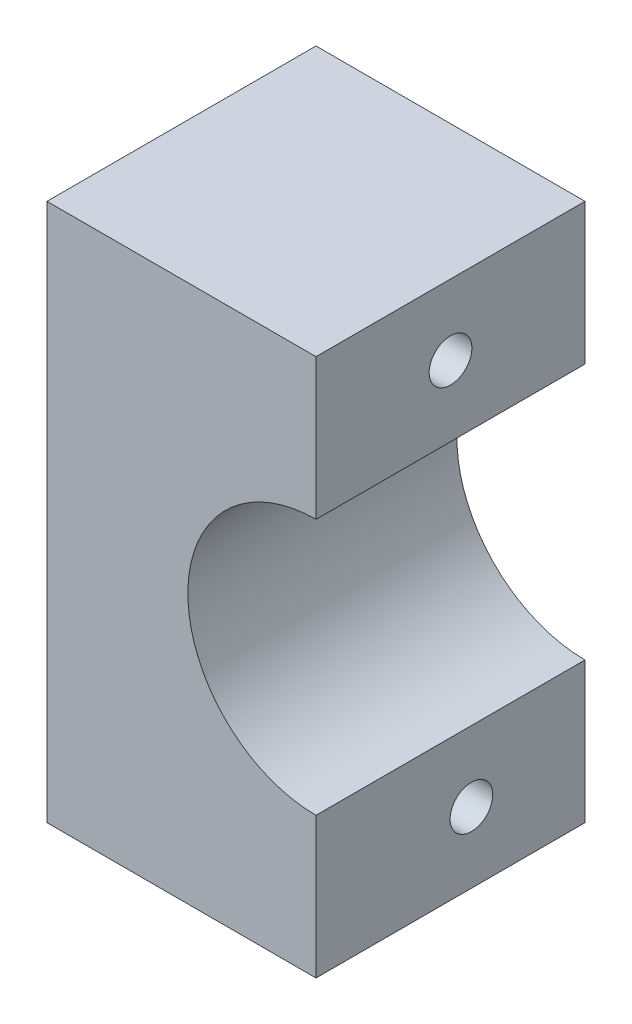
from build123d import *

# Parameters (mm, degrees)
EXTRUDE_1_DEPTH     = 10
SKETCH_2_R          = 0.79375
CUT_EXTRUDE_1_DEPTH = 18.320508076


with BuildPart() as part:
    # 草图1 → 凸台-拉伸1 (new body)
    with BuildSketch(Plane.XY):
        with BuildLine():
            Line((0, 4.7625), (0, 10))
            Line((0, 10), (-10, 10))
            Line((-10, 10), (-10, -10))
            Line((-10, -10), (0, -10))
            Line((0, -10), (0, -4.7625))
            ThreePointArc((0, -4.7625), (-4.7625, 0), (0, 4.7625))
        make_face()
    extrude(amount=EXTRUDE_1_DEPTH)

    # 草图2 → 切除-拉伸1 (cut, through all)
    with BuildSketch(Plane(origin=(0, 0, 0), x_dir=(0, 0, -1), z_dir=(1, 0, 0))):
        with Locations((-5, 7.38125)):
            Circle(SKETCH_2_R)
        with Locations((-4.222922478, -7.38125)):
            Circle(SKETCH_2_R)
    extrude(amount=-CUT_EXTRUDE_1_DEPTH, mode=Mode.SUBTRACT)


solid = part.part
